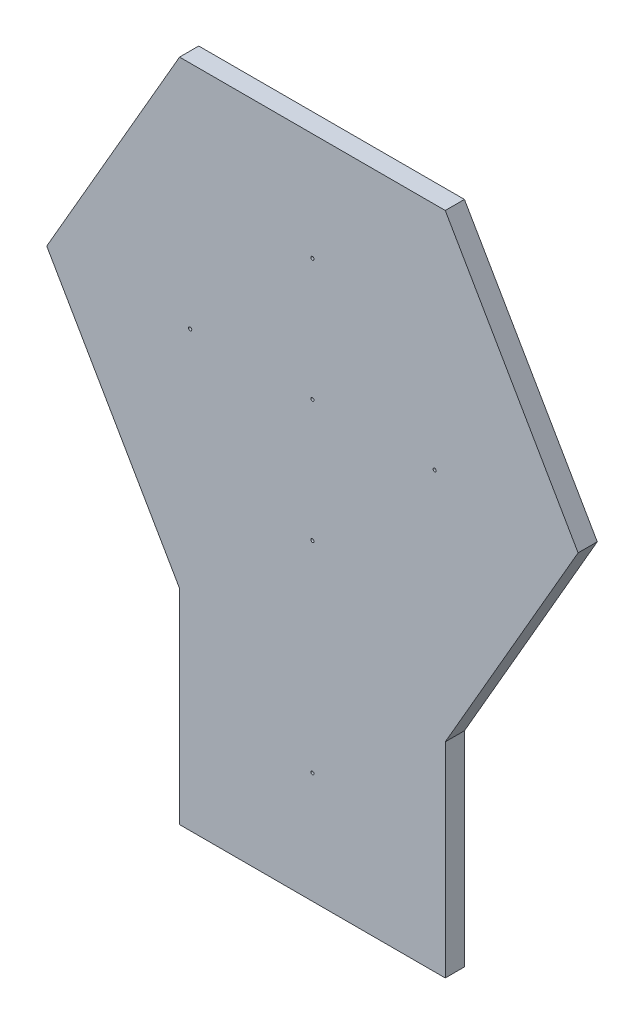
from build123d import *

# Parameters (mm, degrees)
BOSS_EXTRUDE1_DEPTH = 19.05
SKETCH2_W           = 263.964543074
SKETCH2_H           = 203.2
BOSS_EXTRUDE2_DEPTH = 19.05
SKETCH4_R           = 1.5875
CUT_EXTRUDE1_DEPTH  = 507.449822292
SKETCH5_R           = 1.5875
CUT_EXTRUDE2_DEPTH  = 507.449822292


with BuildPart() as part:
    # Sketch1 → Boss-Extrude1 (new body)
    with BuildSketch(Plane.XY):
        Polygon((-131.982271537, 228.6), (131.982271537, 228.6), (263.964543073, 0), (131.982271537, -228.6), (-131.982271537, -228.6), (-263.964543073, 0), align=None)
    extrude(amount=BOSS_EXTRUDE1_DEPTH)

    # Sketch2 → Boss-Extrude2 (add)
    with BuildSketch(Plane.XY.offset(19.05)):
        with Locations((0, -330.2)):
            Rectangle(SKETCH2_W, SKETCH2_H)
    extrude(amount=-BOSS_EXTRUDE2_DEPTH)

    # Sketch4 → Cut-Extrude1 (cut, through all)
    with BuildSketch(Plane.XY.offset(19.05)):
        Circle(SKETCH4_R)
        with Locations((0, -321.31)):
            Circle(SKETCH4_R)
    extrude(amount=-CUT_EXTRUDE1_DEPTH, mode=Mode.SUBTRACT)

    # Sketch5 → Cut-Extrude2 (cut, through all)
    with BuildSketch(Plane.XY.offset(19.05)):
        with Locations((-121.44375, 0)):
            Circle(SKETCH5_R)
        with Locations((0, 121.44375)):
            Circle(SKETCH5_R)
        with Locations((121.44375, 0)):
            Circle(SKETCH5_R)
        with Locations((0, -121.44375)):
            Circle(SKETCH5_R)
    extrude(amount=-CUT_EXTRUDE2_DEPTH, mode=Mode.SUBTRACT)


solid = part.part
